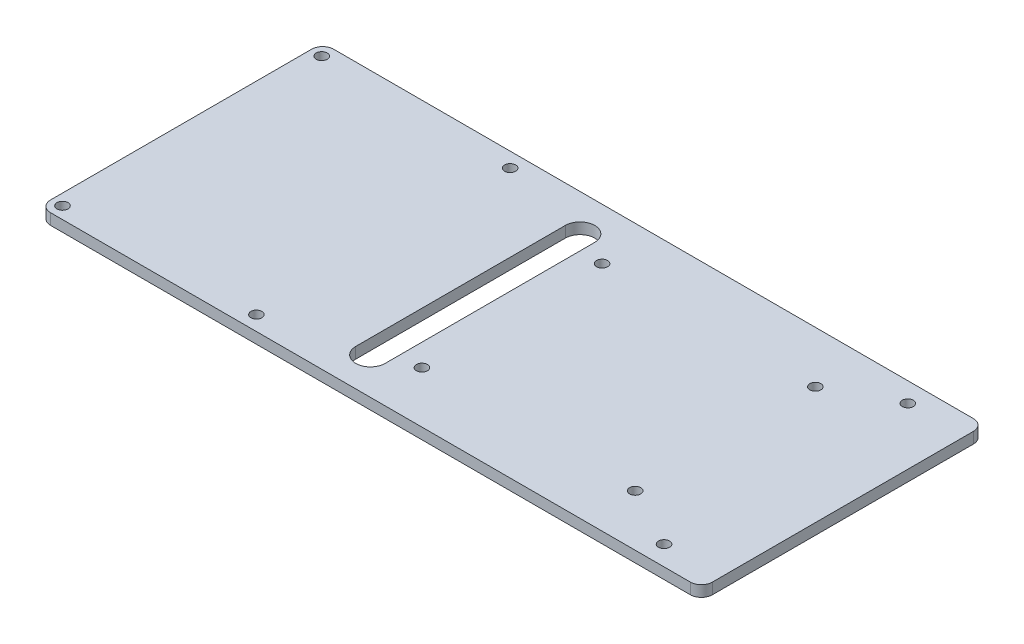
from build123d import *

# Parameters (mm, degrees)
SKETCH1_W           = 180
SKETCH1_H           = 77
SKETCH1_R           = 1.5
SKETCH1_R_2         = 1.500742376
BOSS_EXTRUDE1_DEPTH = 3
FILLET1_R           = 3
SKETCH2_R           = 1.5
CUT_EXTRUDE1_DEPTH  = 3


with BuildPart() as part:
    # Sketch1 → Boss-Extrude1 (new body)
    with BuildSketch(Plane(origin=(0, 0, 0), x_dir=(1, 0, 0), z_dir=(0, 1, 0))):
        Rectangle(SKETCH1_W, SKETCH1_H)
        with Locations(Location((-87, 35.25, 0), (0, 0, 270))):
            Circle(SKETCH1_R, mode=Mode.SUBTRACT)
        with Locations(Location((-87, -35.25, 0), (0, 0, 90))):
            Circle(SKETCH1_R, mode=Mode.SUBTRACT)
        with Locations(Location((-35.005408935, 34.5, 0), (0, 0, 270))):
            Circle(SKETCH1_R, mode=Mode.SUBTRACT)
        with Locations(Location((-35.005408935, -34.5, 0), (0, 0, 90))):
            Circle(SKETCH1_R, mode=Mode.SUBTRACT)
        with Locations(Location((74.494591065, 33.15, 0), (0, 0, 270))):
            Circle(SKETCH1_R_2, mode=Mode.SUBTRACT)
        with Locations(Location((74.494591065, -33.15, 0), (0, 0, 270))):
            Circle(SKETCH1_R, mode=Mode.SUBTRACT)
    extrude(amount=BOSS_EXTRUDE1_DEPTH)

    # Fillet1
    fillet1_edges = [part.edges().sort_by_distance(p)[0] for p in [
        (90, 1.5, 38.5),
        (-90, 1.5, 38.5),
        (-90, 1.5, -38.5),
        (90, 1.5, -38.5),
    ]]
    fillet(fillet1_edges, radius=FILLET1_R)

    # Sketch2 → Cut-Extrude1 (cut)
    with BuildSketch(Plane.XZ):
        with Locations(Location((58, 24.5, 0), (0, 0, 270))):
            Circle(SKETCH2_R)
        with Locations(Location((58, -24.5, 0), (0, 0, 270))):
            Circle(SKETCH2_R)
        with Locations(Location((0, -24.5, 0), (0, 0, 270))):
            Circle(SKETCH2_R)
        with Locations(Location((0, 24.5, 0), (0, 0, 270))):
            Circle(SKETCH2_R)
        with BuildLine():
            Line((-14, 28.5), (-14, -28.5))
            ThreePointArc((-14, -28.5), (-10, -32.5), (-6, -28.5))
            Line((-6, -28.5), (-6, 28.5))
            ThreePointArc((-6, 28.5), (-10, 32.5), (-14, 28.5))
        make_face()
    extrude(amount=-CUT_EXTRUDE1_DEPTH, mode=Mode.SUBTRACT)


solid = part.part
